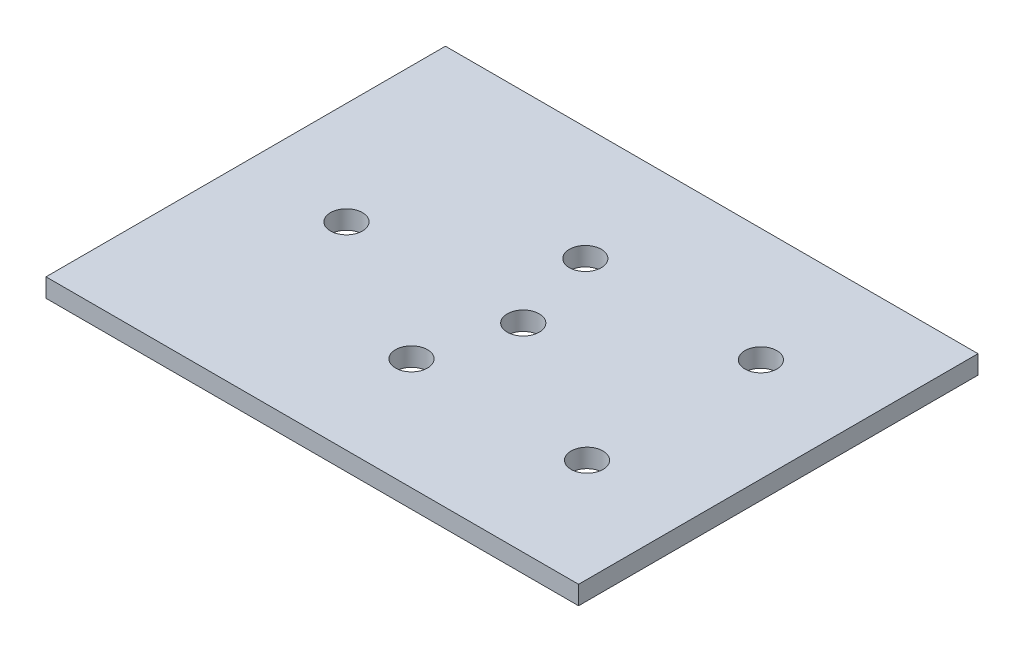
from build123d import *

# Parameters (mm, degrees)
SKETCH1_W                 = 100
SKETCH1_H                 = 75
BOSS_EXTRUDE1_DEPTH       = 3.5
F_6_0MM_DOWEL_HOLE5_D     = 6
F_6_0MM_DOWEL_HOLE5_DEPTH = 5.2
F_6_0MM_DOWEL_HOLE5_TIP   = 1.802581857
F_6_0MM_DOWEL_HOLE6_D     = 6
F_6_0MM_DOWEL_HOLE6_DEPTH = 5.2
F_6_0MM_DOWEL_HOLE6_TIP   = 1.802581857
F_6_0MM_DOWEL_HOLE7_D     = 6
F_6_0MM_DOWEL_HOLE7_DEPTH = 5.2
F_6_0MM_DOWEL_HOLE7_TIP   = 1.802581857
F_6_0MM_DOWEL_HOLE8_D     = 6
F_6_0MM_DOWEL_HOLE8_DEPTH = 5.2
F_6_0MM_DOWEL_HOLE8_TIP   = 1.802581857
F_6_0MM_DOWEL_HOLE9_D     = 6
F_6_0MM_DOWEL_HOLE10_D    = 6


with BuildPart() as part:
    # Sketch1 → Boss-Extrude1 (new body)
    with BuildSketch(Plane(origin=(0, 0, 0), x_dir=(1, 0, 0), z_dir=(0, 1, 0))):
        with Locations((-13.448964329, -14.251552142)):
            Rectangle(SKETCH1_W, SKETCH1_H)
    extrude(amount=BOSS_EXTRUDE1_DEPTH)

    # Ø6.0mm Dowel Hole5
    with Locations(Plane(origin=(-137.528418299, 0, 99.034606683), x_dir=(-1, 0, 0), z_dir=(0, -1, 0))):
        with Locations((-154.698850598, 100.900481409)):
            Hole(F_6_0MM_DOWEL_HOLE5_D / 2, depth=F_6_0MM_DOWEL_HOLE5_DEPTH)
            with Locations((0, 0, -(F_6_0MM_DOWEL_HOLE5_DEPTH + F_6_0MM_DOWEL_HOLE5_TIP / 2))):  # 118° drill point
                Cone(0, F_6_0MM_DOWEL_HOLE5_D / 2, F_6_0MM_DOWEL_HOLE5_TIP, mode=Mode.SUBTRACT)

    # Ø6.0mm Dowel Hole6
    with Locations(Plane(origin=(-137.528418299, 0, 99.034606683), x_dir=(-1, 0, 0), z_dir=(0, -1, 0))):
        with Locations((-121.736726509, 100.900481409)):
            Hole(F_6_0MM_DOWEL_HOLE6_D / 2, depth=F_6_0MM_DOWEL_HOLE6_DEPTH)
            with Locations((0, 0, -(F_6_0MM_DOWEL_HOLE6_DEPTH + F_6_0MM_DOWEL_HOLE6_TIP / 2))):  # 118° drill point
                Cone(0, F_6_0MM_DOWEL_HOLE6_D / 2, F_6_0MM_DOWEL_HOLE6_TIP, mode=Mode.SUBTRACT)

    # Ø6.0mm Dowel Hole7
    with Locations(Plane(origin=(-137.528418299, 0, 99.034606683), x_dir=(-1, 0, 0), z_dir=(0, -1, 0))):
        with Locations((-154.698850598, 68.255290468)):
            Hole(F_6_0MM_DOWEL_HOLE7_D / 2, depth=F_6_0MM_DOWEL_HOLE7_DEPTH)
            with Locations((0, 0, -(F_6_0MM_DOWEL_HOLE7_DEPTH + F_6_0MM_DOWEL_HOLE7_TIP / 2))):  # 118° drill point
                Cone(0, F_6_0MM_DOWEL_HOLE7_D / 2, F_6_0MM_DOWEL_HOLE7_TIP, mode=Mode.SUBTRACT)

    # Ø6.0mm Dowel Hole8
    with Locations(Plane(origin=(-137.528418299, 0, 99.034606683), x_dir=(-1, 0, 0), z_dir=(0, -1, 0))):
        with Locations((-121.736726509, 68.255290468)):
            Hole(F_6_0MM_DOWEL_HOLE8_D / 2, depth=F_6_0MM_DOWEL_HOLE8_DEPTH)
            with Locations((0, 0, -(F_6_0MM_DOWEL_HOLE8_DEPTH + F_6_0MM_DOWEL_HOLE8_TIP / 2))):  # 118° drill point
                Cone(0, F_6_0MM_DOWEL_HOLE8_D / 2, F_6_0MM_DOWEL_HOLE8_TIP, mode=Mode.SUBTRACT)

    # Ø6.0mm Dowel Hole9 (through all)
    with Locations(Plane(origin=(-137.528418299, 0, 99.034606683), x_dir=(-1, 0, 0), z_dir=(0, -1, 0))):
        with Locations((-93.346603373, 84.436908191)):
            Hole(F_6_0MM_DOWEL_HOLE9_D / 2)

    # Ø6.0mm Dowel Hole10 (through all)
    with Locations(Plane(origin=(-137.528418299, 0, 99.034606683), x_dir=(-1, 0, 0), z_dir=(0, -1, 0))):
        with Locations((-126.399729662, 84.576636181)):
            Hole(F_6_0MM_DOWEL_HOLE10_D / 2)


solid = part.part
